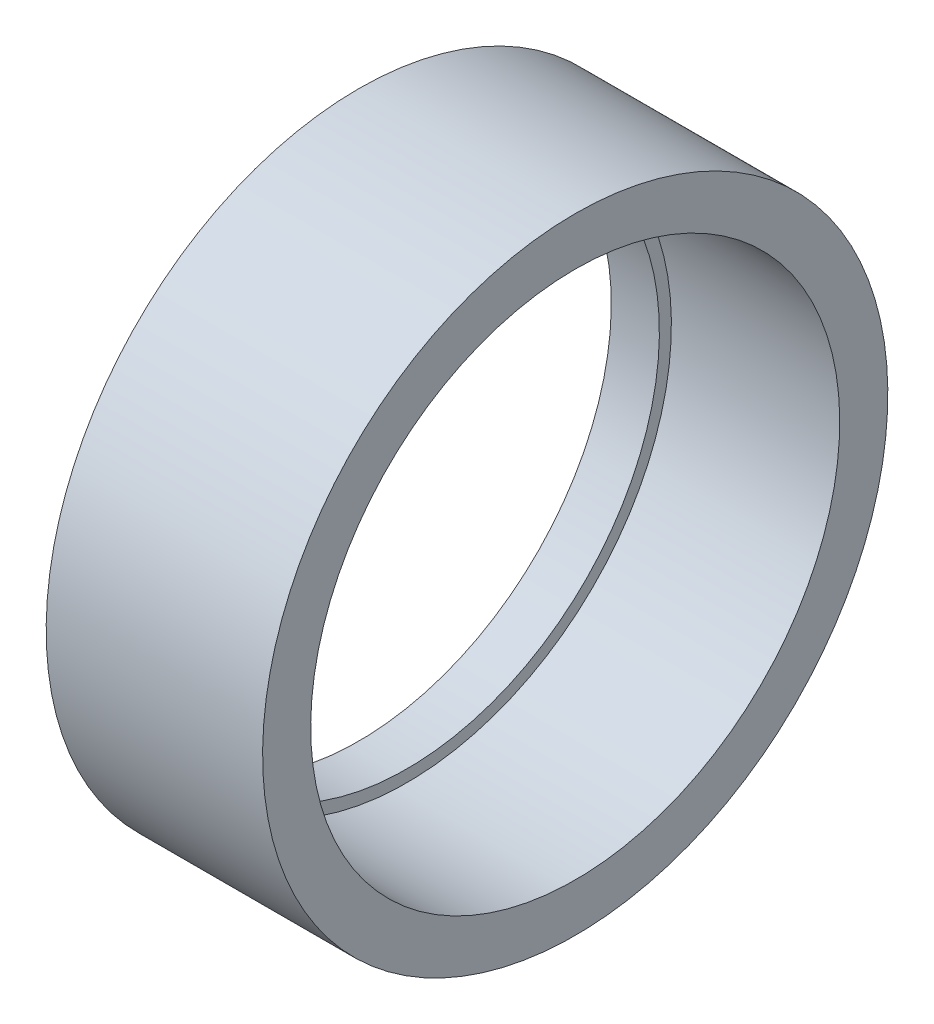
from build123d import *


with BuildPart() as part:
    # Sketch2 → Revolve1 (revolve)
    with BuildSketch(Plane.XY):
        Polygon((0, 11), (0, 13), (-9, 13), (-9, 10.5), (-7, 10.5), (-7, 11), align=None)
    revolve(axis=Axis((0, 0, 0), (-1, 0, 0)))


solid = part.part
